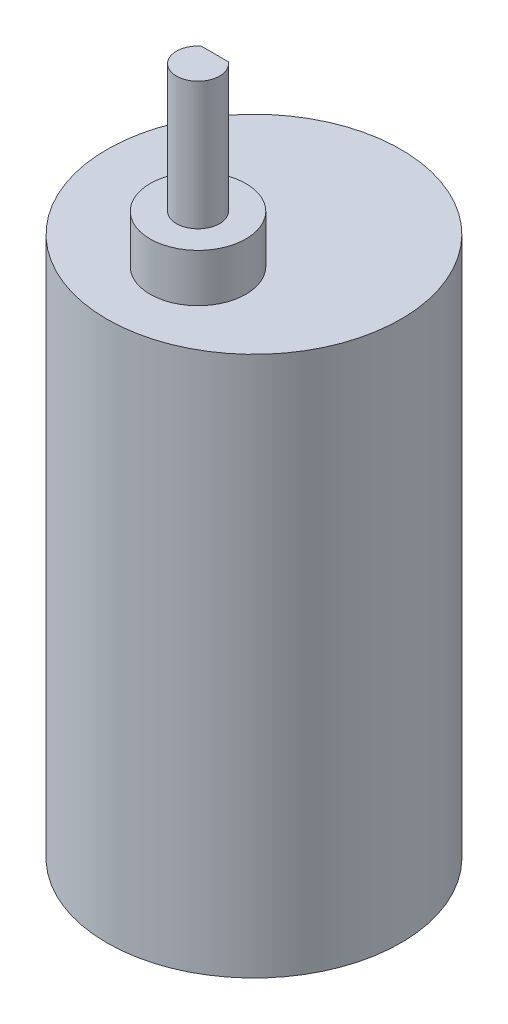
from build123d import *

# Parameters (mm, degrees)
SKETCH1_R           = 18.4
BOSS_EXTRUDE1_DEPTH = 67.6
SKETCH2_R           = 6
BOSS_EXTRUDE2_DEPTH = 6
BOSS_EXTRUDE3_START = -6
BOSS_EXTRUDE3_DEPTH = 22


with BuildPart() as part:
    # Sketch1 → Boss-Extrude1 (new body)
    with BuildSketch(Plane(origin=(0, 0, 0), x_dir=(1, 0, 0), z_dir=(0, 1, 0))):
        with Locations(Location((0, 0, 0), (0, 0, 270))):
            Circle(SKETCH1_R)
    extrude(amount=BOSS_EXTRUDE1_DEPTH)

    # Sketch2 → Boss-Extrude2 (add)
    with BuildSketch(Plane(origin=(0, 67.6, 0), x_dir=(1, 0, 0), z_dir=(0, 1, 0))):
        with Locations(Location((0, -7, 0), (0, 0, 270))):
            Circle(SKETCH2_R)
    extrude(amount=BOSS_EXTRUDE2_DEPTH)

    # Sketch3 → Boss-Extrude3 (add)
    with BuildSketch(Plane(origin=(0, 73.6, 0), x_dir=(1, 0, 0), z_dir=(0, 1, 0)).offset(BOSS_EXTRUDE3_START)):
        with BuildLine():
            Line((-1.697056275, -4.9), (1.697056275, -4.9))
            ThreePointArc((1.697056275, -4.9), (0, -9.7), (-1.697056275, -4.9))
        make_face()
    extrude(amount=BOSS_EXTRUDE3_DEPTH)


solid = part.part
